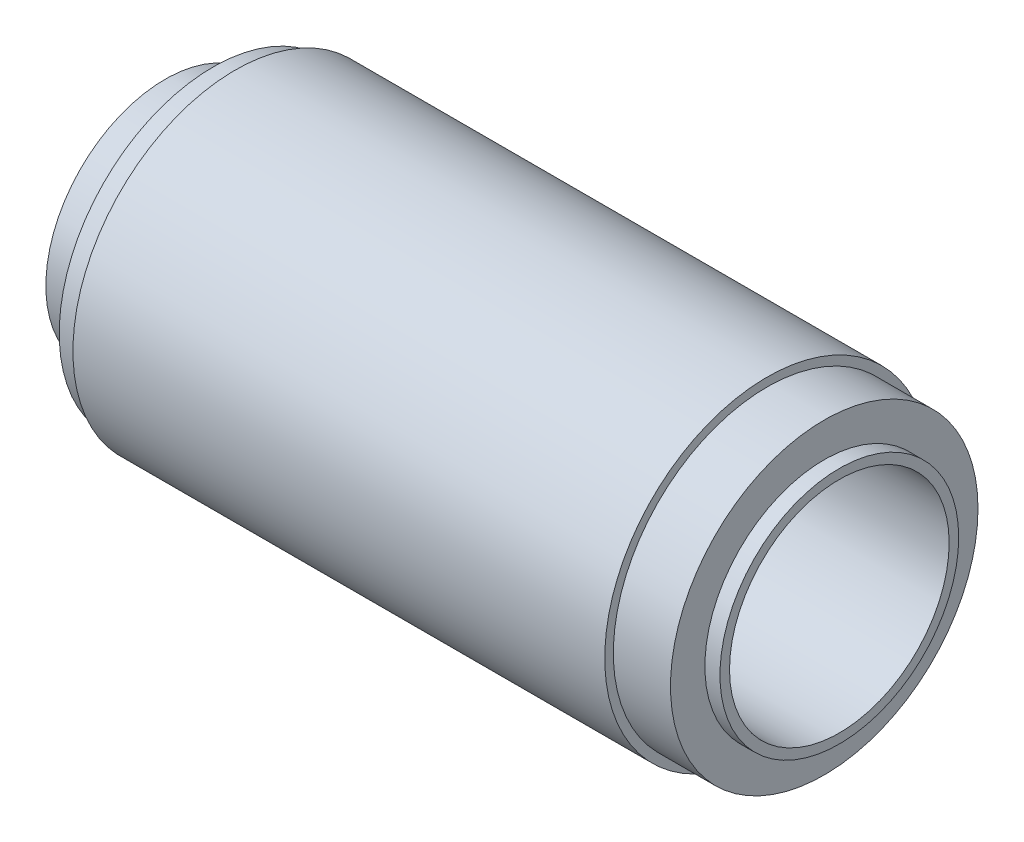
from build123d import *


with BuildPart() as part:
    # Sketch1 → Revolve1 (revolve)
    with BuildSketch(Plane(origin=(0, 0, 0), x_dir=(1, 0, 0), z_dir=(0, 1, 0)), mode=Mode.PRIVATE) as revolve1_sk:
        Polygon((-30.6, -11.5), (-30.6, -12.5), (-32.18, -12.5), (-32.18, -16.1), (-38.165357856, -16.1), (-38.165357856, -17), (-93.853687868, -17), (-93.853687868, -16.1), (-96.19, -16.1), (-96.19, -12.5), (-101.19, -12.5), (-101.19, -11.5), align=None)
    revolve(revolve1_sk.sketch.rotate(Axis((0, 0, 0), (-1, 0, 0)), 180), axis=Axis((0, 0, 0), (-1, 0, 0)))


solid = part.part
